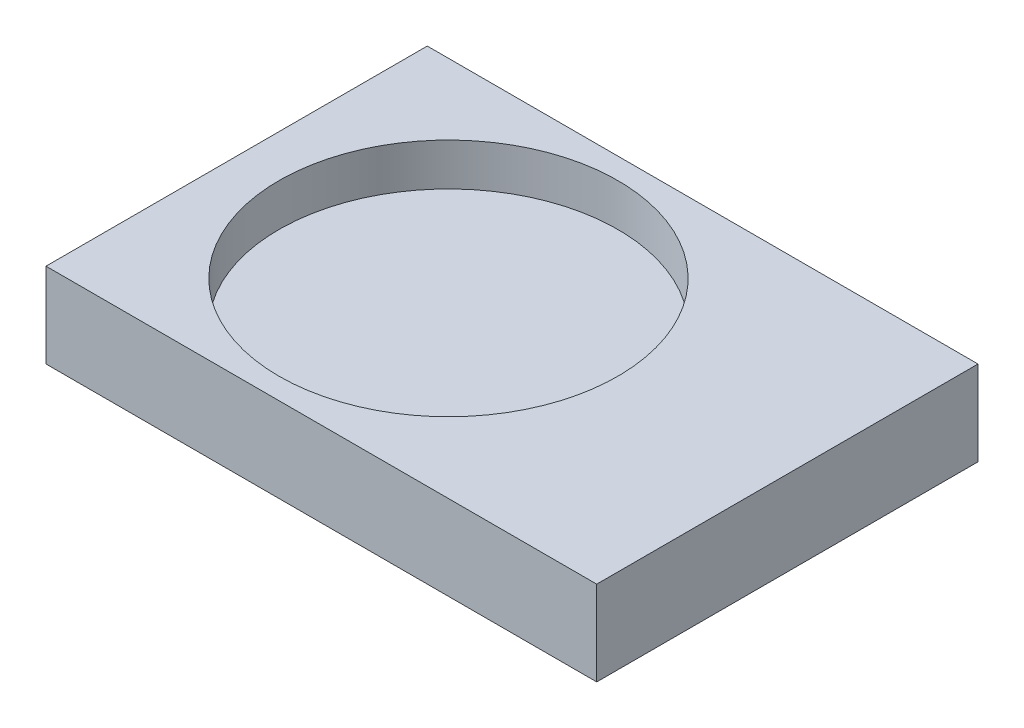
from build123d import *

# Parameters (mm, degrees)
SKETCH1_W           = 650
SKETCH1_H           = 450
BOSS_EXTRUDE1_DEPTH = 100
SKETCH2_R           = 200
CUT_EXTRUDE1_DEPTH  = 50


with BuildPart() as part:
    # Sketch1 → Boss-Extrude1 (new body)
    with BuildSketch(Plane(origin=(0, 0, 0), x_dir=(1, 0, 0), z_dir=(0, 1, 0))):
        with Locations((325, 225)):
            Rectangle(SKETCH1_W, SKETCH1_H)
    extrude(amount=BOSS_EXTRUDE1_DEPTH)

    # Sketch2 → Cut-Extrude1 (cut)
    with BuildSketch(Plane(origin=(0, 100, 0), x_dir=(1, 0, 0), z_dir=(0, 1, 0))):
        with Locations(Location((250, 225, 0), (0, 0, 270))):
            Circle(SKETCH2_R)
    extrude(amount=-CUT_EXTRUDE1_DEPTH, mode=Mode.SUBTRACT)


solid = part.part
